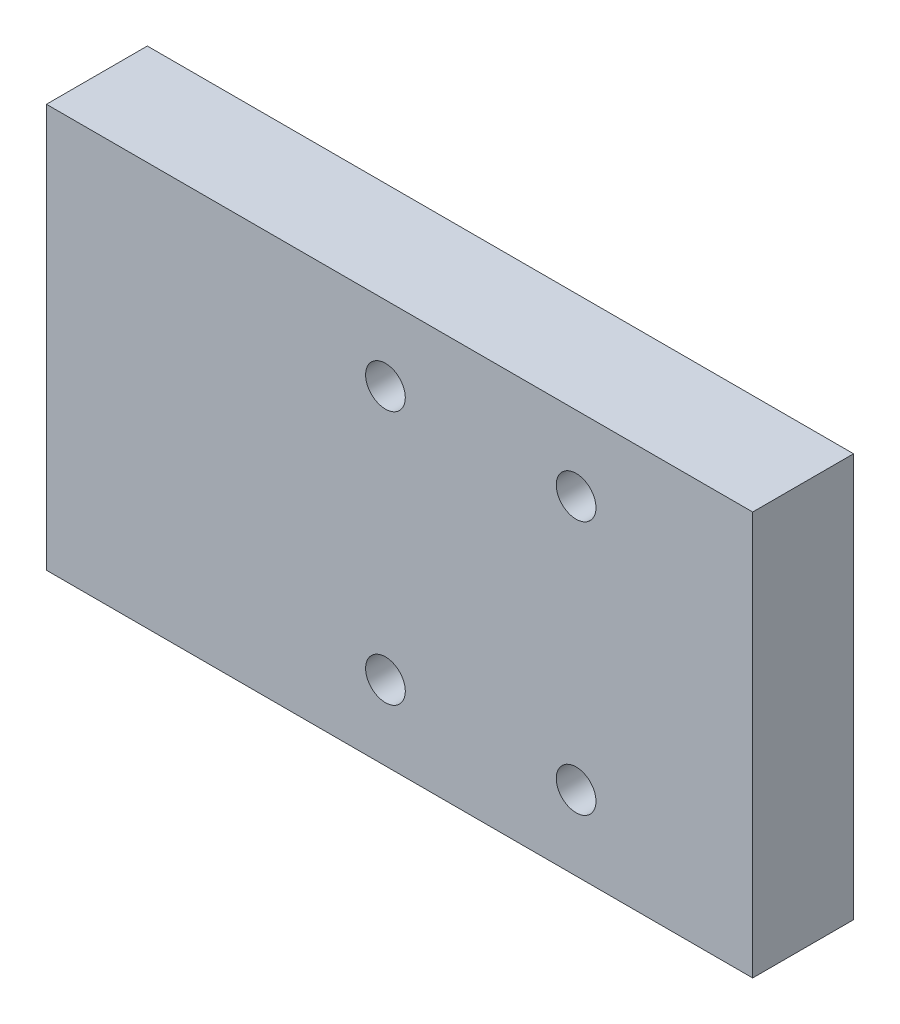
from build123d import *

# Parameters (mm, degrees)
ESQUISSE1_W             = 44.45
ESQUISSE1_H             = 25.4
BOSS_EXTRU_1_DEPTH      = 3.175
ESQUISSE2_R             = 1.24968
ENL_V_MAT_EXTRU_1_DEPTH = 27.373530765


with BuildPart() as part:
    # Esquisse1 → Boss.-Extru.1 (new, symmetric)
    with BuildSketch(Plane.XY):
        Rectangle(ESQUISSE1_W, ESQUISSE1_H)
    extrude(amount=BOSS_EXTRU_1_DEPTH, both=True)

    # Esquisse2 → Enlèv. mat.-Extru.1 (cut, through all)
    with BuildSketch(Plane.XY.offset(3.175)):
        with Locations((-0.8875, 8)):
            Circle(ESQUISSE2_R)
        with Locations((11.1125, 8)):
            Circle(ESQUISSE2_R)
    enl_v_mat_extru_1 = extrude(amount=-ENL_V_MAT_EXTRU_1_DEPTH, mode=Mode.SUBTRACT)

    # Symétrie1: Enlèv. mat.-Extru.1 across plane
    add(enl_v_mat_extru_1.mirror(Plane.ZX), mode=Mode.SUBTRACT)


solid = part.part
